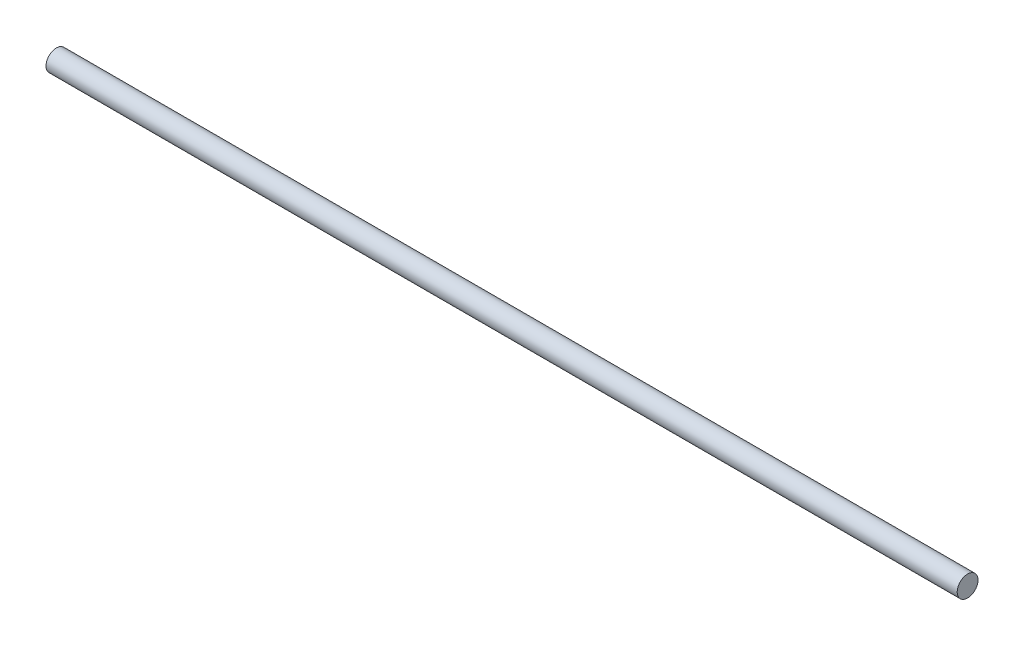
from build123d import *

# Parameters (mm, degrees)
SKETCH1_W = 350
SKETCH1_H = 4


with BuildPart() as part:
    # Sketch1 → Revolve1 (revolve)
    with BuildSketch(Plane.XY, mode=Mode.PRIVATE) as revolve1_sk:
        Rectangle(SKETCH1_W, SKETCH1_H)
    revolve(revolve1_sk.sketch.rotate(Axis((-175, 2, 0), (1, 0, 0)), 270), axis=Axis((-175, 2, 0), (1, 0, 0)))


solid = part.part
